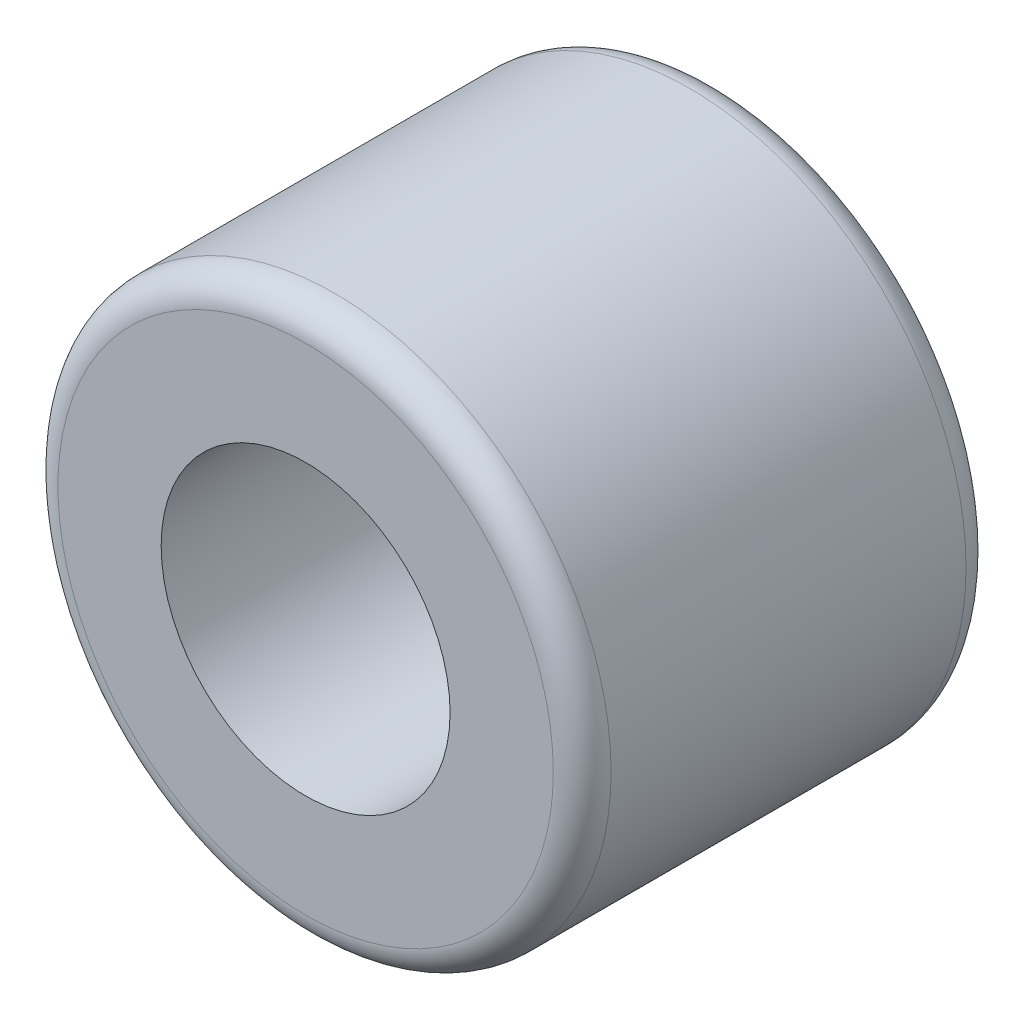
from build123d import *

# Parameters (mm, degrees)
SKETCH1_R           = 8.509
SKETCH1_R_2         = 4.445
BOSS_EXTRUDE1_DEPTH = 12.7
FILLET1_R           = 0.889


with BuildPart() as part:
    # Sketch1 → Boss-Extrude1 (new body)
    with BuildSketch(Plane.XY):
        with Locations(Location((0, 0, 0), (0, 0, 180))):
            Circle(SKETCH1_R)
        with Locations(Location((0, 0, 0), (0, 0, 180))):
            Circle(SKETCH1_R_2, mode=Mode.SUBTRACT)
    extrude(amount=BOSS_EXTRUDE1_DEPTH)

    # Fillet1
    fillet1_edges = [part.edges().sort_by_distance(p)[0] for p in [
        (8.509, 0, 0),
        (8.509, 0, 12.7),
    ]]
    fillet(fillet1_edges, radius=FILLET1_R)


solid = part.part
